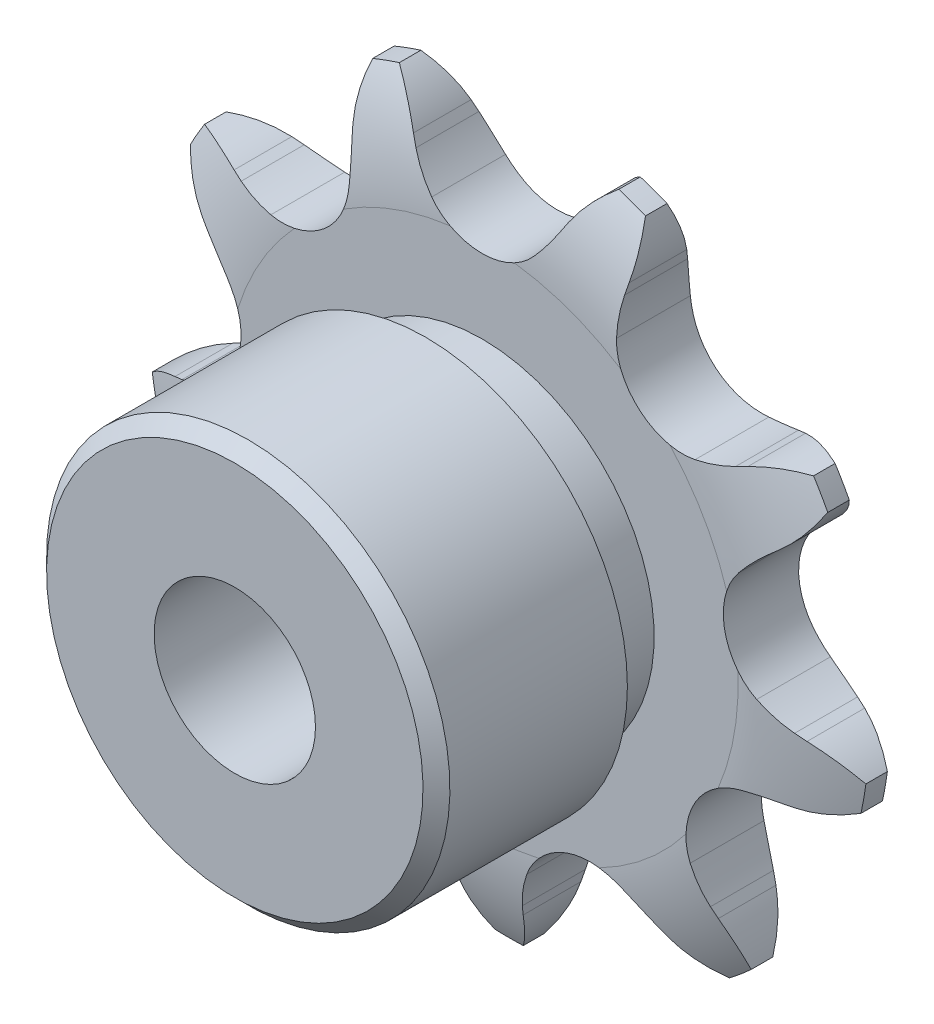
from build123d import *

# Parameters (mm, degrees)
CUT_EXTRUDE1_DEPTH      = 19.987874087
CIRPATTERN1_COUNT       = 9
BOSS_EXTRUDE1_START     = 1.4
SKETCH2_R               = 7.5
BOSS_EXTRUDE1_DEPTH     = 9.2
CUT_EXTRUDE2_DEPTH      = 22.626088937
CUT_EXTRUDE2_DEPTH_BACK = 22.626088937
SKETCH3_R               = 3
SKETCH4_W               = 2.1
SKETCH4_H               = 6.994692077


with BuildPart() as part:
    # Sketch1 → Revolve1 (revolve)
    with BuildSketch(Plane(origin=(0, 0, 0), x_dir=(0, 0, -1), z_dir=(1, 0, 0))):
        with BuildLine():
            Line((1.4, 0), (-1.4, 0))
            Line((-1.4, 0), (-1.4, 9.516926332))
            ThreePointArc((-1.4, 9.516926332), (-1.145966692, 11.516926332), (-0.4, 13.389909678))
            Line((-0.4, 13.389909678), (0.4, 13.389909678))
            ThreePointArc((0.4, 13.389909678), (1.145966692, 11.516926332), (1.4, 9.516926332))
            Line((1.4, 9.516926332), (1.4, 0))
        make_face()
    revolve(axis=Axis((0, 0, -1.4), (0, 0, 1)))

    # Sketch0 → Cut-Extrude1 (cut, symmetric)
    with BuildSketch(Plane.XY):
        with BuildLine():
            Line((6.616949071, -9.749335721), (6.321966392, -9.500839456))
            ThreePointArc((6.321966392, -9.500839456), (5.785682947, -9.094269701), (5.210515703, -8.744868009))
            ThreePointArc((5.210515703, -8.744868009), (3.127643422, -8.593129679), (1.629606205, -10.048212478))
            ThreePointArc((1.629606205, -10.048212478), (1.413593612, -10.68558008), (1.26411466, -11.341746936))
            Line((1.26411466, -11.341746936), (1.197875138, -11.72171733))
            ThreePointArc((1.197875138, -11.72171733), (-0.715404271, -14.586897371), (-4.122150016, -15.100685451))
            ThreePointArc((-4.122150016, -15.100685451), (5.353711364, -14.709201082), (12.864283619, -8.918129222))
            ThreePointArc((12.864283619, -8.918129222), (9.92430836, -10.714358673), (6.616949071, -9.749335721))
        make_face()
    cut_extrude1 = extrude(amount=CUT_EXTRUDE1_DEPTH, both=True, mode=Mode.SUBTRACT)

    # CirPattern1: Cut-Extrude1 ×9 about axis
    cirpattern1_axis = Axis((0, 0, 0), (0, 0, 1))
    for i in range(1, CIRPATTERN1_COUNT):
        add(cut_extrude1.rotate(cirpattern1_axis, i * 360 / CIRPATTERN1_COUNT), mode=Mode.SUBTRACT)

    # Sketch2 → Boss-Extrude1 (add)
    with BuildSketch(Plane.XY.offset(BOSS_EXTRUDE1_START)):
        with Locations(Location((0, 0, 0), (0, 0, 270))):
            Circle(SKETCH2_R)
    extrude(amount=BOSS_EXTRUDE1_DEPTH)

    # Sketch3 → Cut-Extrude2 (cut, two sides: drawn at the far end of the back side and taken through both)
    with BuildSketch(Plane.XY.offset(-CUT_EXTRUDE2_DEPTH_BACK)):
        Circle(SKETCH3_R)
    extrude(amount=CUT_EXTRUDE2_DEPTH + CUT_EXTRUDE2_DEPTH_BACK, mode=Mode.SUBTRACT)

    # Sketch4 → Cut-Revolve1 (revolve, cut)
    with BuildSketch(Plane(origin=(0, 0, 0), x_dir=(0, 0, -1), z_dir=(1, 0, 0))):
        Polygon((-10.6, 7.5), (-10.6, 7), (-10.1, 7.5), align=None)
        with Locations((-2.45, 9.89256364)):
            Rectangle(SKETCH4_W, SKETCH4_H)
    revolve(axis=Axis((0, 0, -1.4), (0, 0, 1)), mode=Mode.SUBTRACT)


solid = part.part
